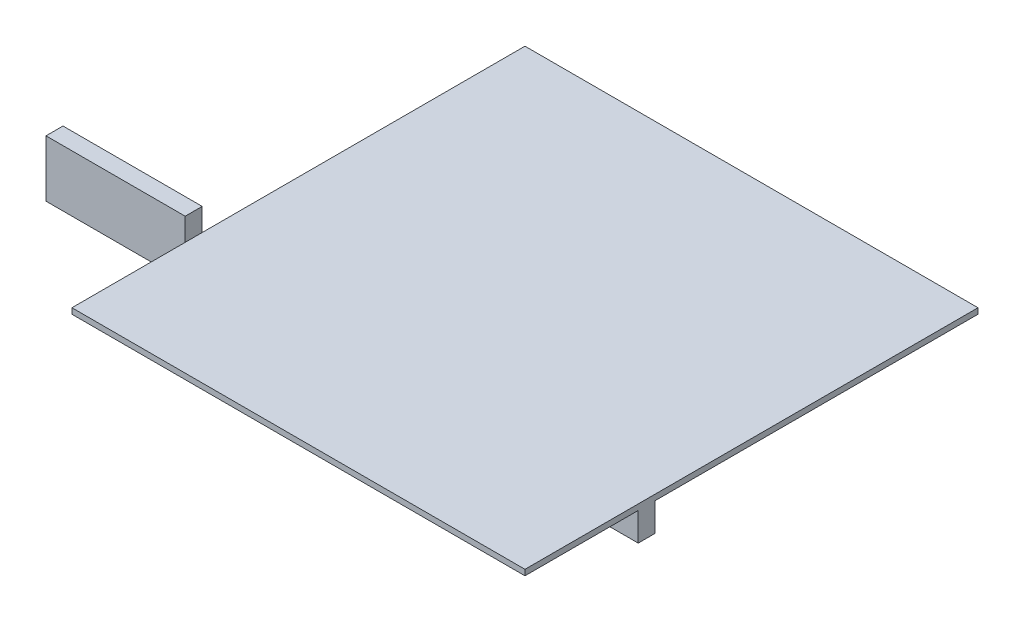
from build123d import *

# Parameters (mm, degrees)
BOSS_EXTRUDE3_DEPTH = 3
SKETCH4_W           = 80
SKETCH4_H           = 80
BOSS_EXTRUDE4_DEPTH = 1


with BuildPart() as part:
    # Sketch1 → Boss-Extrude3 (new body)
    with BuildSketch(Plane.XY):
        Polygon((15.553767031, 1.327814089), (15.553767031, 6.327814089), (-9.026232969, 6.327814089), (-9.026232969, -3.672185911), (5.238144653, -3.672185911), (95.553767031, -3.672185911), (95.553767031, 1.327814089), align=None)
    extrude(amount=BOSS_EXTRUDE3_DEPTH)

    # Sketch4 → Boss-Extrude4 (add)
    with BuildSketch(Plane(origin=(0, 1.327814089, 0), x_dir=(1, 0, 0), z_dir=(0, 1, 0))):
        with Locations((55.553767031, 17)):
            Rectangle(SKETCH4_W, SKETCH4_H)
    extrude(amount=BOSS_EXTRUDE4_DEPTH)


solid = part.part
